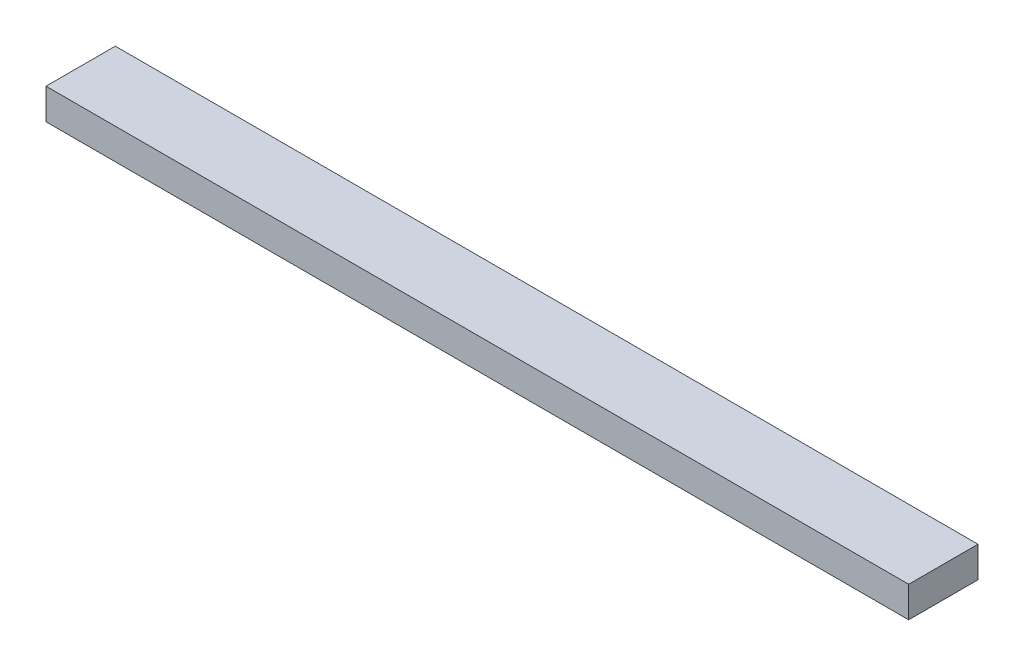
from build123d import *

# Parameters (mm, degrees)
SKETCH1_W           = 142.24
SKETCH1_H           = 11.43
BOSS_EXTRUDE1_DEPTH = 5.08


with BuildPart() as part:
    # Sketch1 → Boss-Extrude1 (new body)
    with BuildSketch(Plane(origin=(0, 0, 0), x_dir=(1, 0, 0), z_dir=(0, 1, 0))):
        with Locations((25.579190028, 24.893926488)):
            Rectangle(SKETCH1_W, SKETCH1_H)
    extrude(amount=BOSS_EXTRUDE1_DEPTH)


solid = part.part
